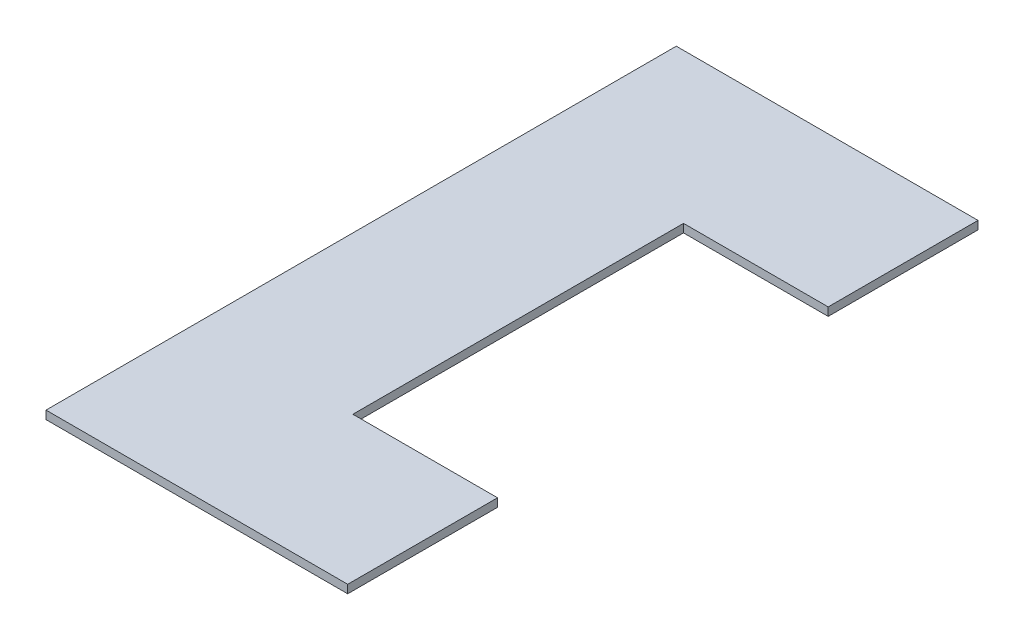
from build123d import *

# Parameters (mm, degrees)
CROQUIS1_W              = 146
CROQUIS1_H              = 310
SALIENTE_EXTRUIR1_DEPTH = 4
CROQUIS2_W              = 146
CROQUIS2_H              = 2.5
CORTAR_EXTRUIR1_DEPTH   = 10
CROQUIS3_W              = 70
CROQUIS3_H              = 160
CORTAR_EXTRUIR2_DEPTH   = 10


with BuildPart() as part:
    # Croquis1 → Saliente-Extruir1 (new body)
    with BuildSketch(Plane(origin=(0, 0, 0), x_dir=(1, 0, 0), z_dir=(0, 1, 0))):
        with Locations((-123, 0)):
            Rectangle(CROQUIS1_W, CROQUIS1_H)
    extrude(amount=SALIENTE_EXTRUIR1_DEPTH)

    # Croquis2 → Cortar-Extruir1 (cut)
    with BuildSketch(Plane(origin=(0, 4, 0), x_dir=(1, 0, 0), z_dir=(0, 1, 0))):
        with Locations((-123, 153.75)):
            Rectangle(CROQUIS2_W, CROQUIS2_H)
        with Locations((-123, -153.75)):
            Rectangle(CROQUIS2_W, CROQUIS2_H)
    extrude(amount=-CORTAR_EXTRUIR1_DEPTH, mode=Mode.SUBTRACT)

    # Croquis3 → Cortar-Extruir2 (cut)
    with BuildSketch(Plane(origin=(0, 4, 0), x_dir=(1, 0, 0), z_dir=(0, 1, 0))):
        with Locations((-85, 0)):
            Rectangle(CROQUIS3_W, CROQUIS3_H)
    extrude(amount=-CORTAR_EXTRUIR2_DEPTH, mode=Mode.SUBTRACT)


solid = part.part
